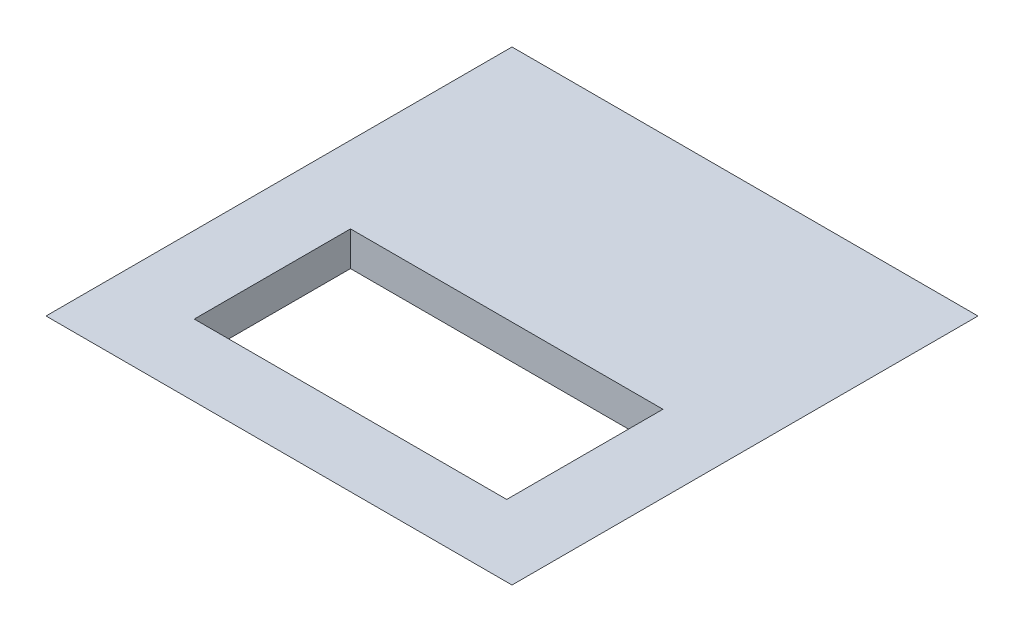
from build123d import *

# Parameters (mm, degrees)
SKETCH1_W           = 150
SKETCH1_H           = 150
BOSS_EXTRUDE1_DEPTH = 13
BOSS_EXTRUDE1_DRAFT = -45
SKETCH2_W           = 118
SKETCH2_H           = 59
CUT_EXTRUDE1_DEPTH  = 13


with BuildPart() as part:
    # Sketch1 → Boss-Extrude1 (with draft: the straight prism first)
    with BuildSketch(Plane(origin=(0, 0, 0), x_dir=(1, 0, 0), z_dir=(0, 1, 0))):
        with Locations((75, 75)):
            Rectangle(SKETCH1_W, SKETCH1_H)
    extrude(amount=BOSS_EXTRUDE1_DEPTH)
    # Boss-Extrude1: the draft: its side faces are tilted about the plane it starts from
    boss_extrude1_sides = [part.faces().sort_by_distance(p)[0] for p in [
        (75, 6.5, 0),
        (150, 6.5, -75),
        (75, 6.5, -150),
        (0, 6.5, -75),
    ]]
    draft(boss_extrude1_sides, Plane(origin=(0, 0, 0), x_dir=(1, 0, 0), z_dir=(0, 1, 0)), BOSS_EXTRUDE1_DRAFT)

    # Sketch2 → Cut-Extrude1 (cut)
    with BuildSketch(Plane(origin=(0, 13, 0), x_dir=(1, 0, 0), z_dir=(0, 1, 0))):
        with Locations((75, 43.5)):
            Rectangle(SKETCH2_W, SKETCH2_H)
    extrude(amount=-CUT_EXTRUDE1_DEPTH, mode=Mode.SUBTRACT)


solid = part.part
